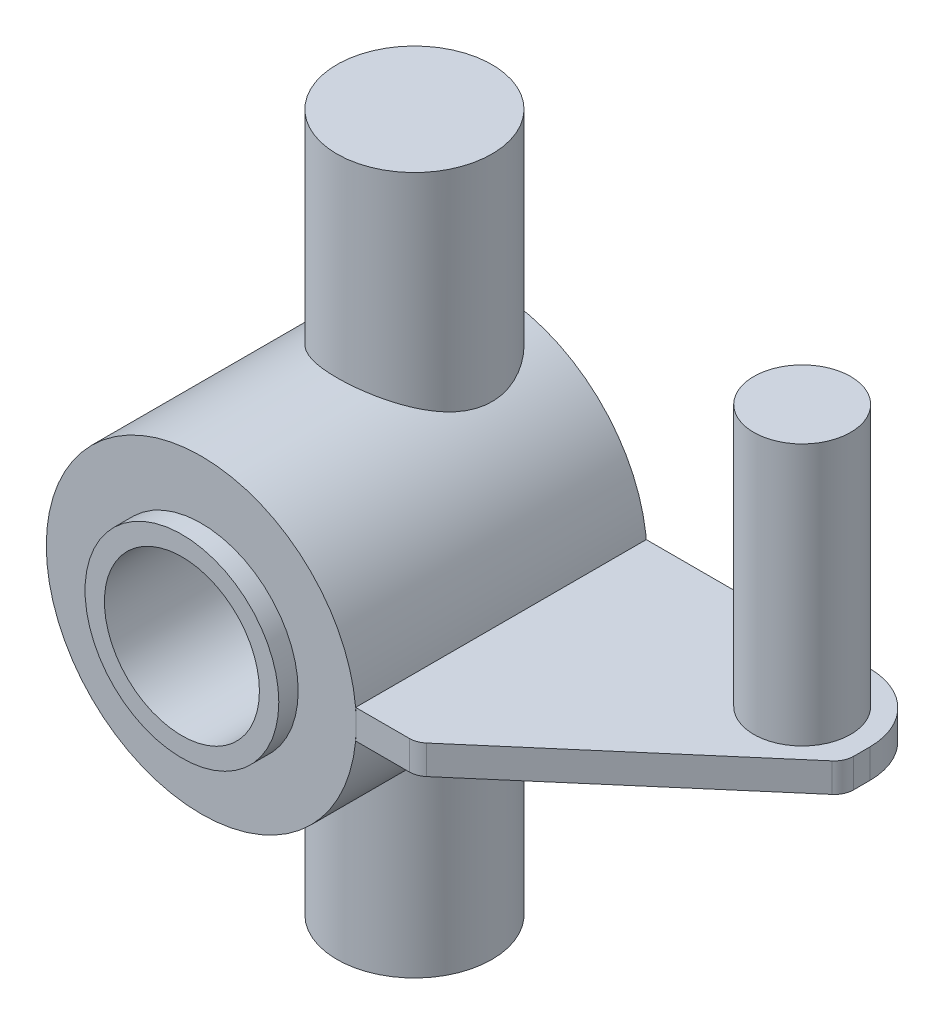
from build123d import *

# Parameters (mm, degrees)
SKETCH1_R                            = 8
BOSS_EXTRUDE1_DEPTH                  = 15
SKETCH2_R                            = 5
SKETCH2_R_2                          = 4
BOSS_EXTRUDE2_DEPTH                  = 1
CUT_EXTRUDE1_START                   = -15
SKETCH3_R                            = 4
CUT_EXTRUDE1_DEPTH                   = 15
SKETCH4_R                            = 4
BOSS_EXTRUDE3_DEPTH                  = 10
BOSS_EXTRUDE3_DIRECTION_2_REACH      = 26
BOSS_EXTRUDE3_DIRECTION_2_END_RADIUS = 8
SKETCH6_R                            = 4
BOSS_EXTRUDE4_DEPTH                  = 10
BOSS_EXTRUDE4_DIRECTION_2_REACH      = 33.559
BOSS_EXTRUDE4_DIRECTION_2_END_RADIUS = 8
SKETCH7_W                            = 15
SKETCH7_H                            = 1.5
BOSS_EXTRUDE5_DEPTH                  = 15
BOSS_EXTRUDE5_DIRECTION_2_REACH      = 30.914
BOSS_EXTRUDE5_DIRECTION_2_END_RADIUS = 8
CUT_EXTRUDE2_DEPTH                   = 15
CUT_EXTRUDE3_DEPTH                   = 15
FILLET1_R                            = 1
FILLET2_R                            = 1
SKETCH12_R                           = 2.5
BOSS_EXTRUDE6_DEPTH                  = 15


with BuildPart() as part:
    # Sketch1 → Boss-Extrude1 (new body)
    with BuildSketch(Plane.XY):
        Circle(SKETCH1_R)
    extrude(amount=BOSS_EXTRUDE1_DEPTH)

    # Sketch2 → Boss-Extrude2 (add)
    with BuildSketch(Plane.XY.offset(15)):
        Circle(SKETCH2_R)
        Circle(SKETCH2_R_2, mode=Mode.SUBTRACT)
    extrude(amount=BOSS_EXTRUDE2_DEPTH)

    # Sketch3 → Cut-Extrude1 (cut)
    with BuildSketch(Plane.XY.offset(15).offset(CUT_EXTRUDE1_START)):
        Circle(SKETCH3_R)
    extrude(amount=CUT_EXTRUDE1_DEPTH, mode=Mode.SUBTRACT)

    # Sketch6 → Boss-Extrude4 (add)
    with BuildSketch(Plane(origin=(0, -8, 0), x_dir=(-1, 0, 0), z_dir=(0, -1, 0))):
        with Locations(Location((0, -4, 0), (0, 0, 270))):
            Circle(SKETCH6_R)
    extrude(amount=BOSS_EXTRUDE4_DEPTH)

    # Boss-Extrude4 direction 2: up to this cylinder (the profile starts outside it)
    boss_extrude4_direction_2_end = Plane(origin=(0, 0, 4), z_dir=(0, 0, -1)) * Cylinder(BOSS_EXTRUDE4_DIRECTION_2_END_RADIUS, 84.118, mode=Mode.PRIVATE)
    # Sketch6 → Boss-Extrude4 direction 2 (add, up to the surface)
    with BuildSketch(Plane(origin=(0, -8, 0), x_dir=(-1, 0, 0), z_dir=(0, -1, 0)), mode=Mode.PRIVATE) as boss_extrude4_direction_2_sk1:
        with Locations(Location((0, -4, 0), (0, 0, 270))):
            Circle(SKETCH6_R)
    boss_extrude4_direction_2_tool1 = extrude(boss_extrude4_direction_2_sk1.sketch, amount=-BOSS_EXTRUDE4_DIRECTION_2_REACH, mode=Mode.PRIVATE) - boss_extrude4_direction_2_end
    add(boss_extrude4_direction_2_tool1.solids().sort_by_distance((0, -8, 4))[0])
    add(boss_extrude4_direction_2_tool1.solids().sort_by_distance((0, -8, 4))[1])


with BuildPart() as body_2:
    # Sketch4 → Boss-Extrude3 (new body)
    with BuildSketch(Plane(origin=(0, 8, 0), x_dir=(1, 0, 0), z_dir=(0, 1, 0))):
        with Locations(Location((0, -4, 0), (0, 0, 270))):
            Circle(SKETCH4_R)
    extrude(amount=BOSS_EXTRUDE3_DEPTH)

    # Boss-Extrude3 direction 2: up to this cylinder (the profile starts outside it)
    boss_extrude3_direction_2_end = Plane(origin=(0, 0, 4), z_dir=(0, 0, -1)) * Cylinder(BOSS_EXTRUDE3_DIRECTION_2_END_RADIUS, 69, mode=Mode.PRIVATE)
    # Sketch4 → Boss-Extrude3 direction 2 (add, up to the surface)
    with BuildSketch(Plane(origin=(0, 8, 0), x_dir=(1, 0, 0), z_dir=(0, 1, 0)), mode=Mode.PRIVATE) as boss_extrude3_direction_2_sk1:
        with Locations(Location((0, -4, 0), (0, 0, 270))):
            Circle(SKETCH4_R)
    boss_extrude3_direction_2_tool1 = extrude(boss_extrude3_direction_2_sk1.sketch, amount=-BOSS_EXTRUDE3_DIRECTION_2_REACH, mode=Mode.PRIVATE) - boss_extrude3_direction_2_end
    add(boss_extrude3_direction_2_tool1.solids().sort_by_distance((0, 8, 4))[0])
    add(boss_extrude3_direction_2_tool1.solids().sort_by_distance((0, 8, 4))[1])


with BuildPart() as body_3:
    # Sketch7 → Boss-Extrude5 (new body)
    with BuildSketch(Plane(origin=(8, 0, 0), x_dir=(0, 0, -1), z_dir=(1, 0, 0))):
        with Locations((-7.5, 0)):
            Rectangle(SKETCH7_W, SKETCH7_H)
    extrude(amount=BOSS_EXTRUDE5_DEPTH)

    # Boss-Extrude5 direction 2: up to this cylinder (the profile starts outside it)
    boss_extrude5_direction_2_end = Plane(origin=(0, 0, 7.5), z_dir=(0, 0, -1)) * Cylinder(BOSS_EXTRUDE5_DIRECTION_2_END_RADIUS, 78.828, mode=Mode.PRIVATE)
    # Sketch7 → Boss-Extrude5 direction 2 (add, up to the surface)
    with BuildSketch(Plane(origin=(8, 0, 0), x_dir=(0, 0, -1), z_dir=(1, 0, 0)), mode=Mode.PRIVATE) as boss_extrude5_direction_2_sk1:
        with Locations((-7.5, 0)):
            Rectangle(SKETCH7_W, SKETCH7_H)
    boss_extrude5_direction_2_tool1 = extrude(boss_extrude5_direction_2_sk1.sketch, amount=-BOSS_EXTRUDE5_DIRECTION_2_REACH, mode=Mode.PRIVATE) - boss_extrude5_direction_2_end
    add(boss_extrude5_direction_2_tool1.solids().sort_by_distance((8, 0, 7.5))[0])
    add(boss_extrude5_direction_2_tool1.solids().sort_by_distance((8, 0, 7.5))[1])

    # Sketch9 → Cut-Extrude2 (cut)
    with BuildSketch(Plane.XZ.offset(0.75)):
        with BuildLine():
            ThreePointArc((23, 3.5), (21.974873734, 1.025126266), (19.5, 0))
            Line((19.5, 0), (23, 0))
            Line((23, 0), (23, 3.5))
        make_face()
    extrude(amount=-CUT_EXTRUDE2_DEPTH, mode=Mode.SUBTRACT)

    # Sketch11 → Cut-Extrude3 (cut)
    with BuildSketch(Plane(origin=(0, -0.75, 0), x_dir=(-1, 0, 0), z_dir=(0, -1, 0))):
        Polygon((-23, -15), (-11.108053079, -15), (-23, -4.792841708), align=None)
    extrude(amount=-CUT_EXTRUDE3_DEPTH, mode=Mode.SUBTRACT)

    # Fillet1
    fillet1_edges = [body_3.edges().sort_by_distance(p)[0] for p in [
        (11.108053079, 0, 15),
    ]]
    fillet(fillet1_edges, radius=FILLET1_R)

    # Fillet2
    fillet2_edges = [body_3.edges().sort_by_distance(p)[0] for p in [
        (23, 0, 4.792841708),
    ]]
    fillet(fillet2_edges, radius=FILLET2_R)

    # Sketch12 → Boss-Extrude6 (add)
    with BuildSketch(Plane.XZ.offset(0.75)):
        with Locations(Location((19.446318933, 3.434994956, 0), (0, 0, 270))):
            Circle(SKETCH12_R)
    extrude(amount=-BOSS_EXTRUDE6_DEPTH)


solid = Compound([part.part, body_2.part, body_3.part])
